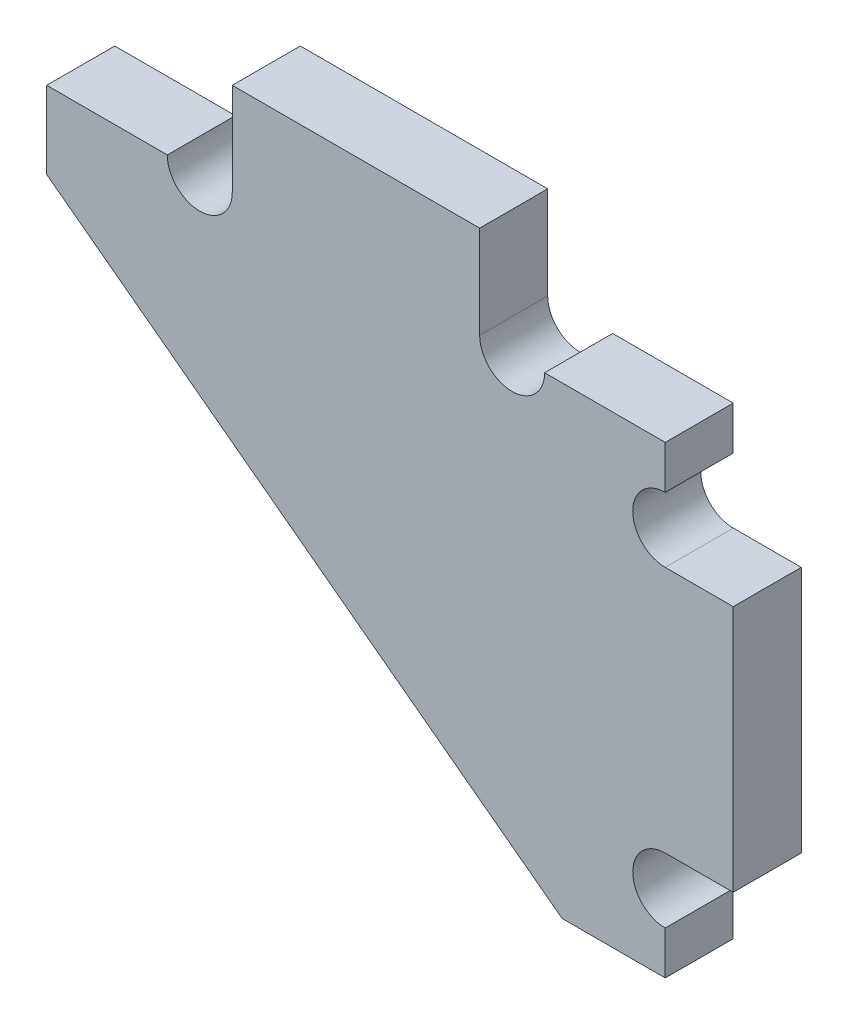
from build123d import *

# Parameters (mm, degrees)
EXTRUDE_1_DEPTH = 2.2


with BuildPart() as part:
    # 草图1 → 凸台-拉伸1 (new body)
    with BuildSketch(Plane.XY):
        with BuildLine():
            Line((-4, 10.5), (-4, 7.5))
            ThreePointArc((-4, 7.5), (-5.05, 6.45), (-6.1, 7.5))
            Line((-6.1, 7.5), (-10, 7.5))
            Line((-10, 7.5), (-10, 5))
            Line((-10, 5), (6.666666667, -7.5))
            Line((6.666666667, -7.5), (10, -7.5))
            Line((10, -7.5), (10, -6.1))
            ThreePointArc((10, -6.1), (8.95, -5.05), (10, -4))
            Line((10, -4), (12.2, -4))
            Line((12.2, -4), (12.2, 4))
            Line((12.2, 4), (10, 4))
            ThreePointArc((10, 4), (8.95, 5.05), (10, 6.1))
            Line((10, 6.1), (10, 7.5))
            Line((10, 7.5), (6.1, 7.5))
            ThreePointArc((6.1, 7.5), (5.05, 6.45), (4, 7.5))
            Line((4, 7.5), (4, 10.5))
            Line((4, 10.5), (-4, 10.5))
        make_face()
    extrude(amount=EXTRUDE_1_DEPTH)


solid = part.part
